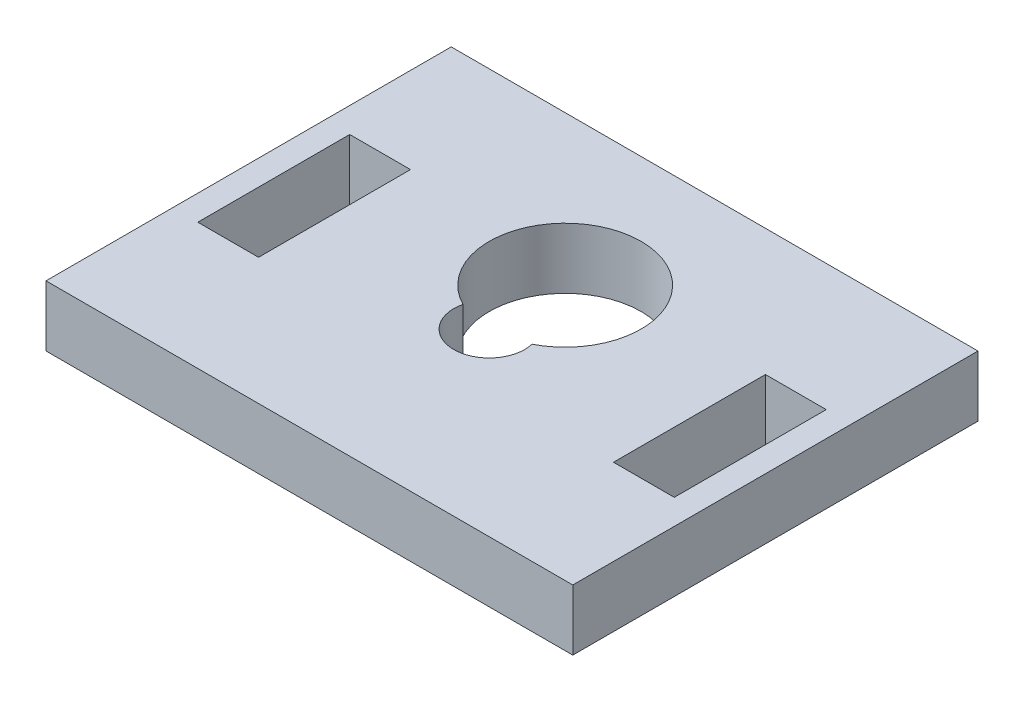
from build123d import *

# Parameters (mm, degrees)
CROQUIS1_W              = 52
CROQUIS1_H              = 40
SALIENTE_EXTRUIR1_DEPTH = 3
CROQUIS2_W              = 6
CROQUIS2_H              = 15
CORTAR_EXTRUIR1_DEPTH   = 34.346664001
CORTAR_EXTRUIR2_DEPTH   = 34.346664001


with BuildPart() as part:
    # Croquis1 → Saliente-Extruir1 (new, symmetric)
    with BuildSketch(Plane(origin=(0, 0, 0), x_dir=(1, 0, 0), z_dir=(0, 1, 0))):
        Rectangle(CROQUIS1_W, CROQUIS1_H)
    extrude(amount=SALIENTE_EXTRUIR1_DEPTH, both=True)

    # Croquis2 → Cortar-Extruir1 (cut, through all)
    with BuildSketch(Plane(origin=(0, 3, 0), x_dir=(1, 0, 0), z_dir=(0, 1, 0))):
        with Locations((-20.51875, 0)):
            Rectangle(CROQUIS2_W, CROQUIS2_H)
        with Locations((20.51875, 0)):
            Rectangle(CROQUIS2_W, CROQUIS2_H)
    extrude(amount=-CORTAR_EXTRUIR1_DEPTH, mode=Mode.SUBTRACT)

    # Croquis3 → Cortar-Extruir2 (cut, through all)
    with BuildSketch(Plane(origin=(0, 3, 0), x_dir=(1, 0, 0), z_dir=(0, 1, 0))):
        with BuildLine():
            ThreePointArc((3.403388834, -1.433333333), (0, 12.75), (-3.403388834, -1.433333333))
            ThreePointArc((-3.403388834, -1.433333333), (0, -5.75), (3.403388834, -1.433333333))
        make_face()
    extrude(amount=-CORTAR_EXTRUIR2_DEPTH, mode=Mode.SUBTRACT)


solid = part.part
